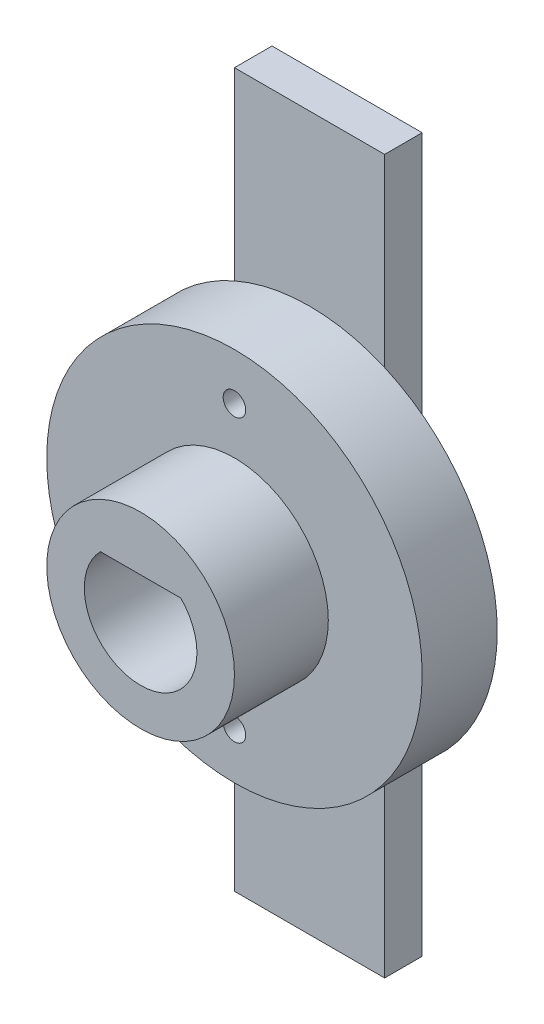
from build123d import *

# Parameters (mm, degrees)
ESQUISSE1_R        = 10
ESQUISSE1_R_2      = 0.6
BOSS_EXTRU_1_DEPTH = 4
ESQUISSE3_R        = 5
BOSS_EXTRU_2_DEPTH = 5
ESQUISSE4_W        = 8
ESQUISSE4_H        = 38
BOSS_EXTRU_3_DEPTH = 2


with BuildPart() as part:
    # Esquisse1 → Boss.-Extru.1 (new body)
    with BuildSketch(Plane.XY):
        Circle(ESQUISSE1_R)
        with Locations((0, -7.5)):
            Circle(ESQUISSE1_R_2, mode=Mode.SUBTRACT)
        with Locations((0, 7.5)):
            Circle(ESQUISSE1_R_2, mode=Mode.SUBTRACT)
    extrude(amount=BOSS_EXTRU_1_DEPTH)

    # Esquisse3 → Boss.-Extru.2 (add)
    with BuildSketch(Plane.XY.offset(4)):
        Circle(ESQUISSE3_R)
        with BuildLine():
            Line((-2.142428529, 2.1), (2.142428529, 2.1))
            ThreePointArc((2.142428529, 2.1), (0, -3), (-2.142428529, 2.1))
        make_face(mode=Mode.SUBTRACT)
    extrude(amount=BOSS_EXTRU_2_DEPTH)

    # Esquisse4 → Boss.-Extru.3 (add)
    with BuildSketch(Plane(origin=(0, 0, 0), x_dir=(-1, 0, 0), z_dir=(0, 0, -1))):
        Rectangle(ESQUISSE4_W, ESQUISSE4_H)
    extrude(amount=BOSS_EXTRU_3_DEPTH)


solid = part.part
